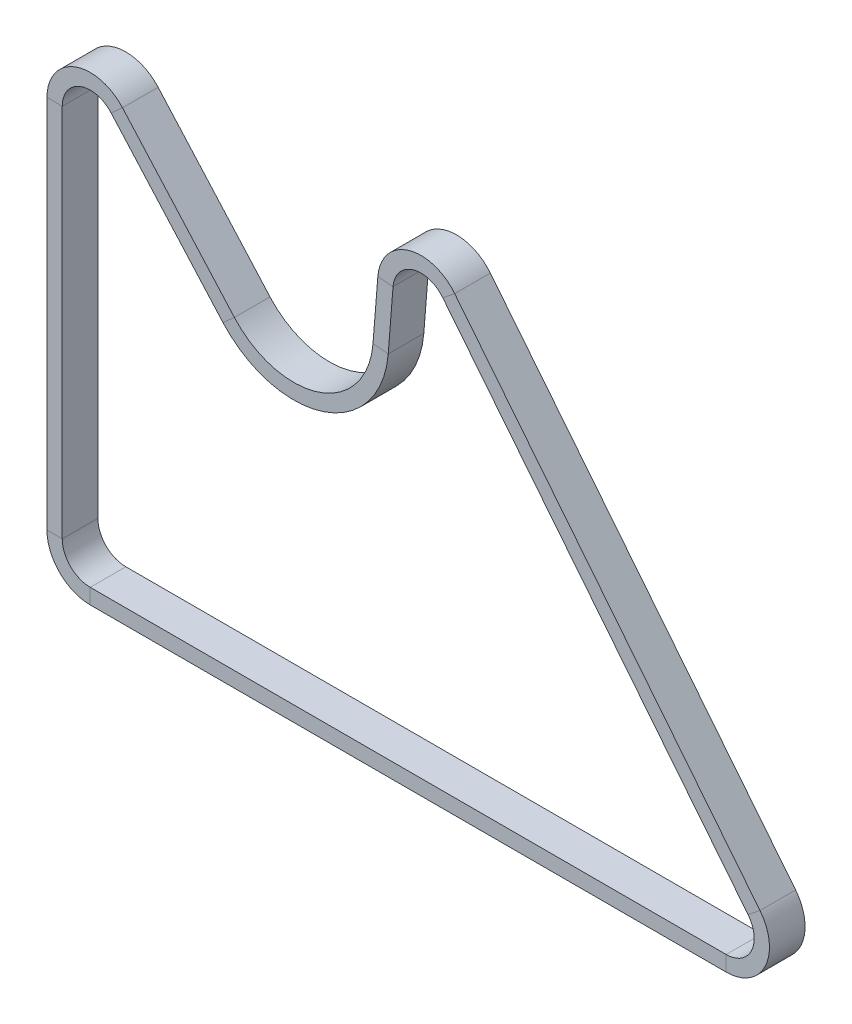
from build123d import *

# Parameters (mm, degrees)
SKETCH3_W = 14
SKETCH3_H = 6


with BuildPart() as part:
    # Sweep1: sweep along a path in Sketch2
    with BuildLine(Plane.XY) as sweep1_path:
        Line((64.14139557, 7.274636075), (66.044393052, 31.114017371))
        ThreePointArc((66.044393052, 31.114017371), (75.895604213, 43.384839753), (90.932163332, 38.745730666))
        Line((90.932163332, 38.745730666), (210.932163332, -111.254269334))
        ThreePointArc((210.932163332, -111.254269334), (212.618245308, -126.064642227), (200, -134))
        Line((200, -134), (-50, -134))
        ThreePointArc((-50, -134), (-59.899494937, -129.899494937), (-64, -120))
        Line((-64, -120), (-64, 27.282396409))
        ThreePointArc((-64, 27.282396409), (-54.981361234, 40.366204733), (-39.544851392, 36.593135778))
        Line((-39.544851392, 36.593135778), (4.422225727, -12.778058812))
        ThreePointArc((4.422225727, -12.778058812), (40.902364216, -22.46846092), (64.14139557, 7.274636075))
    # Sketch3 → Sweep1 (sweep)
    with BuildSketch(Plane(origin=(-50, -134, 0), x_dir=(0, 0, 1), z_dir=(-1, 0, 0))):
        Rectangle(SKETCH3_W, SKETCH3_H)
    sweep(path=sweep1_path.line)


solid = part.part
